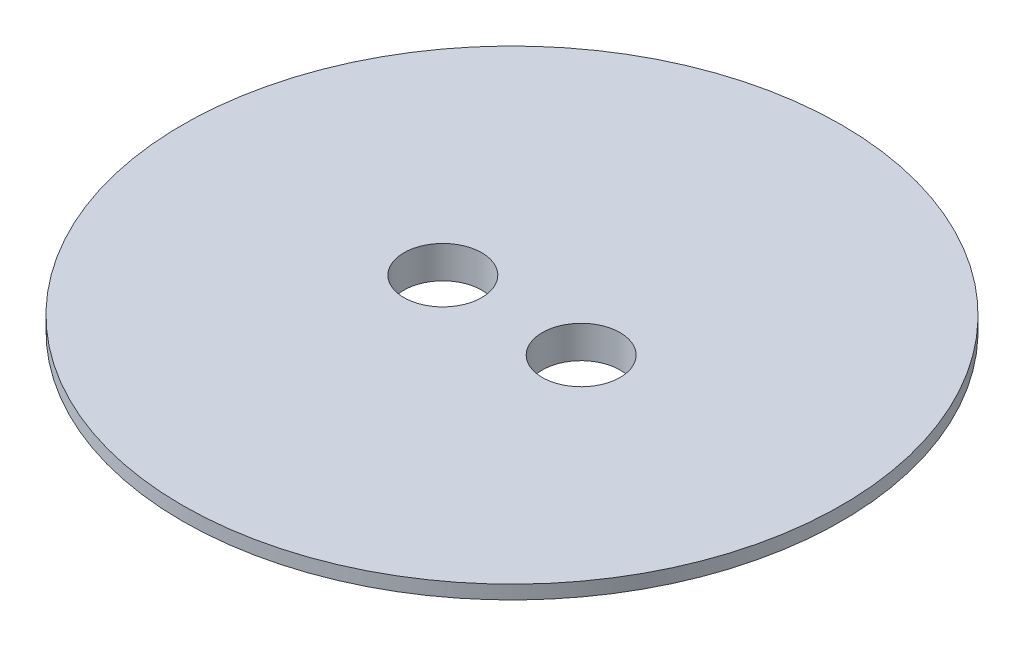
from build123d import *

# Parameters (mm, degrees)
SKETCH2_R           = 19.3675
SKETCH2_R_2         = 2.286
BOSS_EXTRUDE1_DEPTH = 1.905
CHAMFER1_SIZE       = 1.905
CHAMFER1_SIZE2      = 1.099852263


with BuildPart() as part:
    # Sketch2 → Boss-Extrude1 (new body)
    with BuildSketch(Plane(origin=(0, 0, 0), x_dir=(1, 0, 0), z_dir=(0, 1, 0))):
        with Locations(Location((0, 0, 0), (0, 0, 90))):
            Circle(SKETCH2_R)
        with Locations(Location((-4.064, 0, 0), (0, 0, 90))):
            Circle(SKETCH2_R_2, mode=Mode.SUBTRACT)
        with Locations(Location((4.064, 0, 0), (0, 0, 90))):
            Circle(SKETCH2_R_2, mode=Mode.SUBTRACT)
    extrude(amount=BOSS_EXTRUDE1_DEPTH)

    # Chamfer1
    chamfer1_edges = [part.edges().sort_by_distance(p)[0] for p in [
        (0, 0, 19.3675),
    ]]
    chamfer1_side = [part.faces().sort_by_distance(p)[0] for p in [
        (0, 0, 0),
    ]]
    chamfer(chamfer1_edges, length=CHAMFER1_SIZE, length2=CHAMFER1_SIZE2, reference=chamfer1_side[0])


solid = part.part
